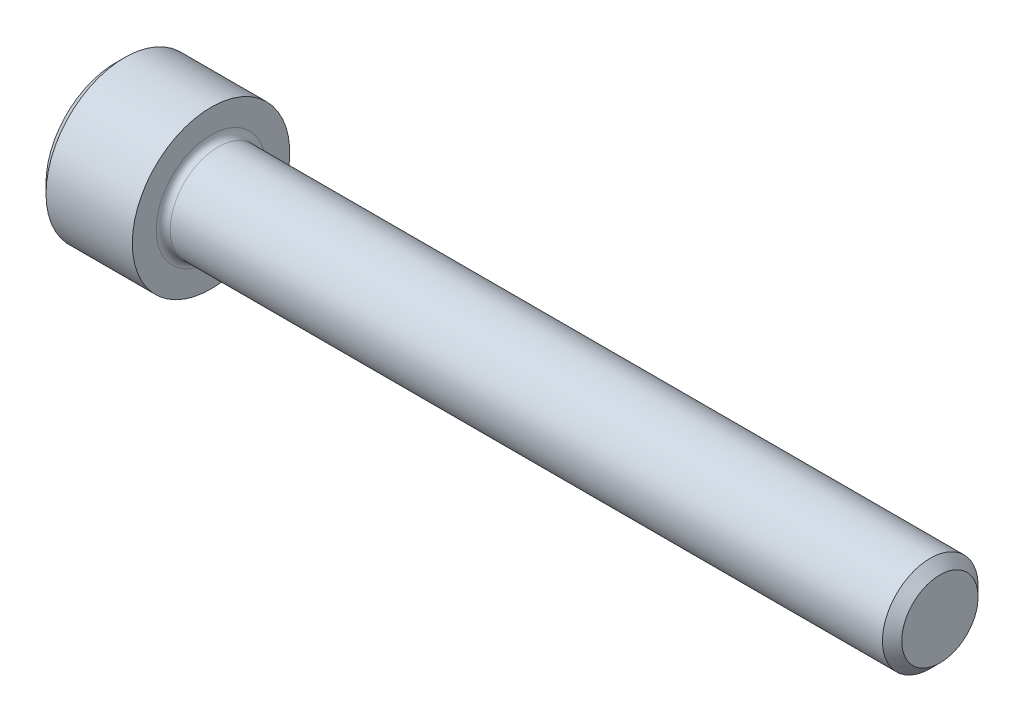
from build123d import *

# Parameters (mm, degrees)
FILLET1_R   = 0.3048
HEX_2_DEPTH = 1.9558


with BuildPart() as part:
    # BodySke → Base-Revolve (revolve)
    with BuildSketch(Plane.XY, mode=Mode.PRIVATE) as base_revolve_sk:
        Polygon((0, 0), (0, 3.0226), (0.4064, 3.429), (4.1656, 3.429), (4.1656, 2.0828), (35.49523, 2.0828), (35.9156, 1.66243), (35.9156, 0), align=None)
    revolve(base_revolve_sk.sketch.rotate(Axis((-31.75, 0, 0), (1, 0, 0)), 90), axis=Axis((-31.75, 0, 0), (1, 0, 0)))

    # Fillet1
    fillet1_edges = [part.edges().sort_by_distance(p)[0] for p in [
        (4.1656, 0, -2.0828),
    ]]
    fillet(fillet1_edges, radius=FILLET1_R)

    # Sketch2 → Hex-PreBroach (revolve, cut)
    with BuildSketch(Plane.XY, mode=Mode.PRIVATE) as hex_prebroach_sk:
        Polygon((0, 1.778), (1.9558, 1.778), (2.982328779, 0), (0, 0), align=None)
    revolve(hex_prebroach_sk.sketch.rotate(Axis((0, 0, 0), (1, 0, 0)), 90), axis=Axis((0, 0, 0), (1, 0, 0)), mode=Mode.SUBTRACT)

    # Sketch3 → Hex 2 (cut)
    with BuildSketch(Plane(origin=(0, 0, 0), x_dir=(0, 0.500000000000001, 0.866025403784438), z_dir=(-1, 0, 0))):
        Polygon((1.026528779, 1.778), (-1.026528779, 1.778), (-2.053057557, 0), (-1.026528779, -1.778), (1.026528779, -1.778), (2.053057557, 0), align=None)
    extrude(amount=-HEX_2_DEPTH, mode=Mode.SUBTRACT)


solid = part.part
